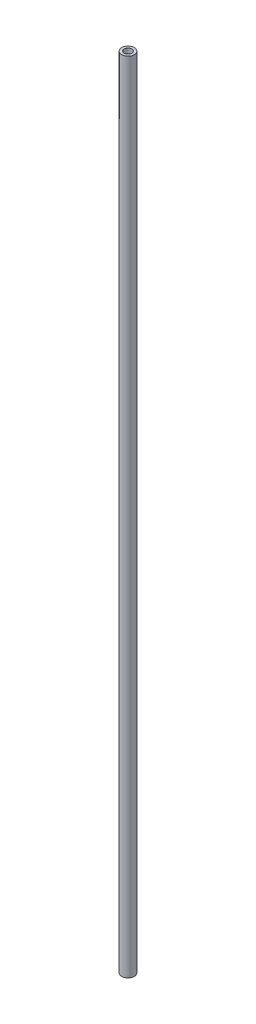
from build123d import *

# Parameters (mm, degrees)
SKETCH1_R           = 2.5
SKETCH1_R_2         = 1.5
BOSS_EXTRUDE1_DEPTH = 318.399999978


with BuildPart() as part:
    # Sketch1 → Boss-Extrude1 (new body)
    with BuildSketch(Plane(origin=(0, 0, 0), x_dir=(1, 0, 0), z_dir=(0, 1, 0))):
        with Locations(Location((0, 0, 0), (0, 0, 270))):
            Circle(SKETCH1_R)
        with Locations(Location((0, 0, 0), (0, 0, 270))):
            Circle(SKETCH1_R_2, mode=Mode.SUBTRACT)
    extrude(amount=BOSS_EXTRUDE1_DEPTH)


solid = part.part
